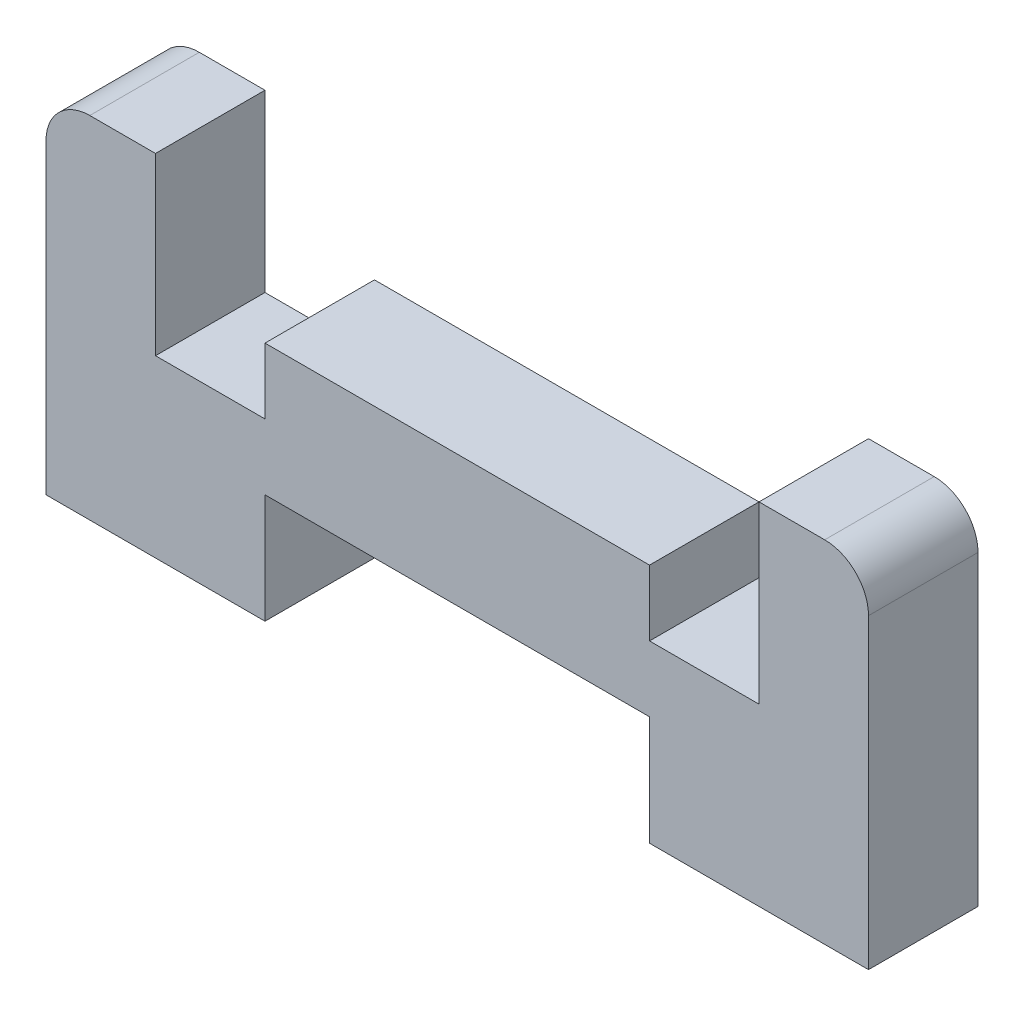
from build123d import *

# Parameters (mm, degrees)
BOSS_EXTRUDE1_DEPTH = 6.35


with BuildPart() as part:
    # Sketch1 → Boss-Extrude1 (new body)
    with BuildSketch(Plane.XY):
        with BuildLine():
            Line((-11.1506, 0), (11.1506, 0))
            Line((11.1506, 0), (11.1506, -3.81))
            Line((11.1506, -3.81), (17.5006, -3.81))
            Line((17.5006, -3.81), (17.5006, 0))
            Line((17.5006, 0), (17.5006, 6.35))
            Line((17.5006, 6.35), (21.3106, 6.35))
            ThreePointArc((21.3106, 6.35), (23.106651224, 5.606051224), (23.8506, 3.81))
            Line((23.8506, 3.81), (23.8506, -7.62))
            Line((23.8506, -7.62), (23.8506, -13.97))
            Line((23.8506, -13.97), (11.1506, -13.97))
            Line((11.1506, -13.97), (11.1506, -7.62))
            Line((11.1506, -7.62), (-11.1506, -7.62))
            Line((-11.1506, -7.62), (-11.1506, -13.97))
            Line((-11.1506, -13.97), (-23.8506, -13.97))
            Line((-23.8506, -13.97), (-23.8506, -7.62))
            Line((-23.8506, -7.62), (-23.8506, 3.81))
            ThreePointArc((-23.8506, 3.81), (-23.106651224, 5.606051224), (-21.3106, 6.35))
            Line((-21.3106, 6.35), (-17.5006, 6.35))
            Line((-17.5006, 6.35), (-17.5006, 0))
            Line((-17.5006, 0), (-17.5006, -3.81))
            Line((-17.5006, -3.81), (-11.1506, -3.81))
            Line((-11.1506, -3.81), (-11.1506, 0))
        make_face()
    extrude(amount=BOSS_EXTRUDE1_DEPTH)


solid = part.part
